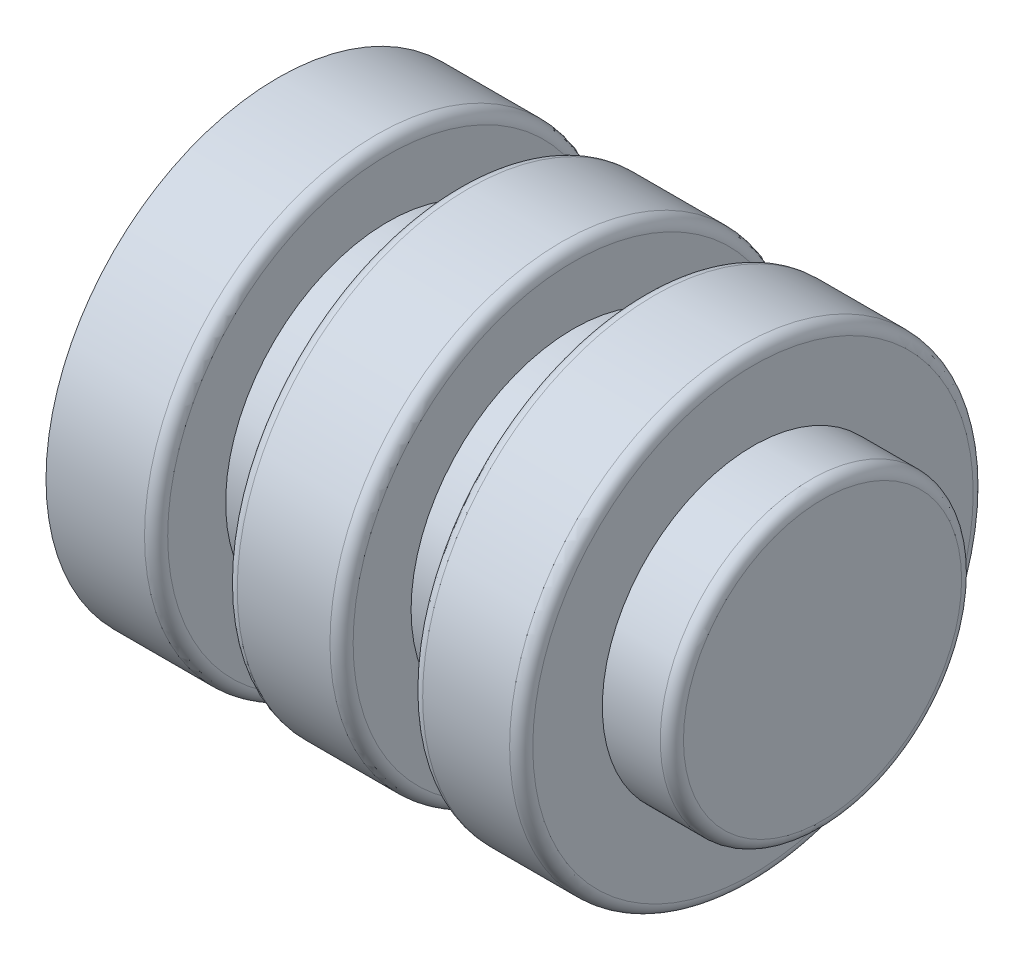
from build123d import *

# Parameters (mm, degrees)
SKETCH1_R           = 10
BOSS_EXTRUDE1_DEPTH = 4.75
SKETCH4_R           = 6.5
BOSS_EXTRUDE2_DEPTH = 3
SKETCH5_R           = 7
BOSS_EXTRUDE3_DEPTH = 3
FILLET1_R           = 0.5
BOSS_EXTRUDE4_START = 5
SKETCH6_R           = 10
BOSS_EXTRUDE4_DEPTH = 5
SKETCH7_R           = 7
BOSS_EXTRUDE5_DEPTH = 3
BOSS_EXTRUDE6_START = 4.75
SKETCH9_R           = 10
BOSS_EXTRUDE6_DEPTH = 4.75
FILLET2_R           = 0.5


with BuildPart() as part:
    # Sketch1 → Boss-Extrude1 (new body)
    with BuildSketch(Plane(origin=(0, 0, 0), x_dir=(0, 0, -1), z_dir=(1, 0, 0))):
        Circle(SKETCH1_R)
    extrude(amount=BOSS_EXTRUDE1_DEPTH)

    # Sketch4 → Boss-Extrude2 (add)
    with BuildSketch(Plane(origin=(4.75, 0, 0), x_dir=(0, 0, -1), z_dir=(1, 0, 0))):
        Circle(SKETCH4_R)
    extrude(amount=BOSS_EXTRUDE2_DEPTH)

    # Sketch5 → Boss-Extrude3 (add)
    with BuildSketch(Plane.ZY):
        with Locations(Location((0, 0, 0), (0, 0, 180))):
            Circle(SKETCH5_R)
    extrude(amount=BOSS_EXTRUDE3_DEPTH)

    # Fillet1
    fillet1_edges = [part.edges().sort_by_distance(p)[0] for p in [
        (7.75, 0, 6.5),
    ]]
    fillet(fillet1_edges, radius=FILLET1_R)

    # Sketch6 → Boss-Extrude4 (add)
    with BuildSketch(Plane.ZY.offset(3).offset(BOSS_EXTRUDE4_START)):
        with Locations(Location((0, 0, 0), (0, 0, 180))):
            Circle(SKETCH6_R)
    extrude(amount=-BOSS_EXTRUDE4_DEPTH)

    # Sketch7 → Boss-Extrude5 (add)
    with BuildSketch(Plane.ZY.offset(8)):
        with Locations(Location((0, 0, 0), (0, 0, 180))):
            Circle(SKETCH7_R)
    extrude(amount=BOSS_EXTRUDE5_DEPTH)

    # Sketch9 → Boss-Extrude6 (add)
    with BuildSketch(Plane.ZY.offset(11).offset(BOSS_EXTRUDE6_START)):
        with Locations(Location((0, 0, 0), (0, 0, 180))):
            Circle(SKETCH9_R)
    extrude(amount=-BOSS_EXTRUDE6_DEPTH)

    # Fillet2
    fillet2_edges = [part.edges().sort_by_distance(p)[0] for p in [
        (-3, 0, 10),
        (-8, 0, 10),
        (0, 0, 10),
        (-11, 0, 10),
        (4.75, 0, 10),
    ]]
    fillet(fillet2_edges, radius=FILLET2_R)


solid = part.part
